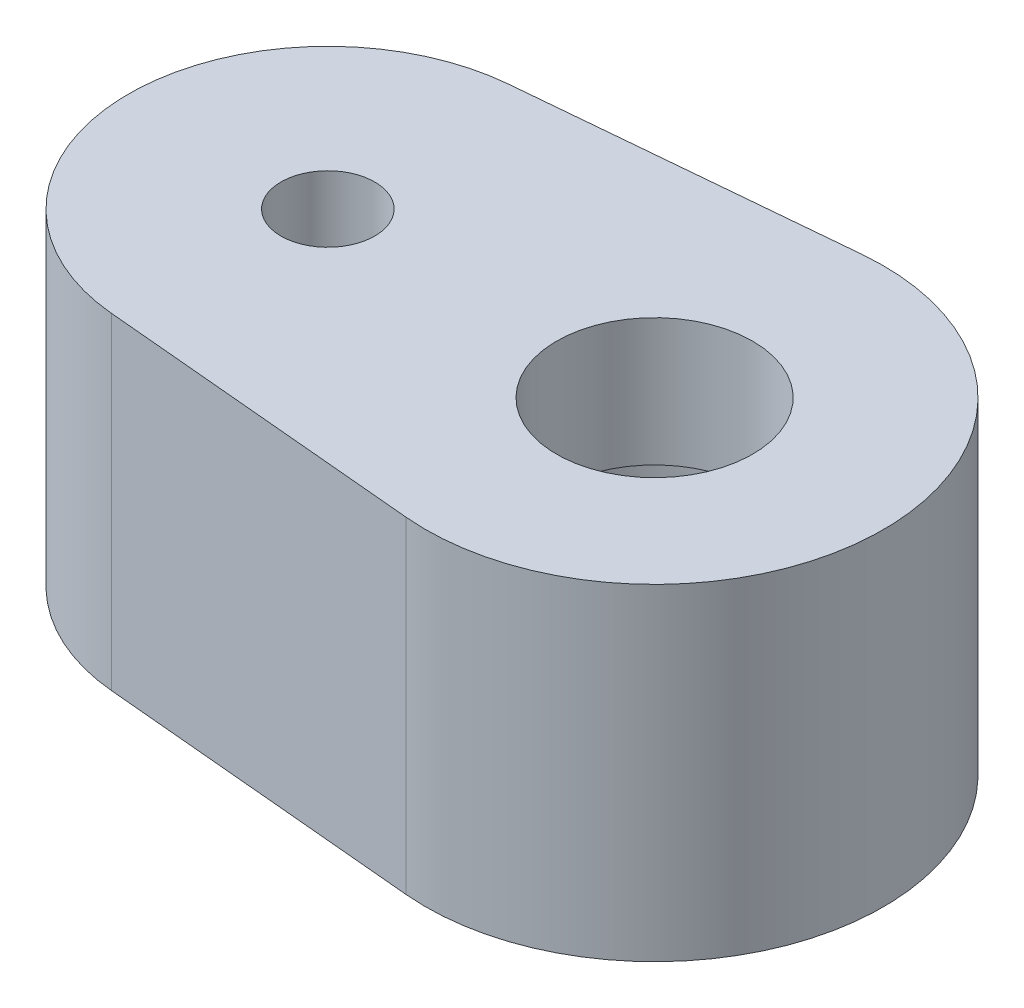
from build123d import *

# Parameters (mm, degrees)
BOSS_EXTRUDE1_DEPTH      = 1
BOSS_EXTRUDE1_DEPTH_BACK = 1
CUT_EXTRUDE1_REACH       = 6.041
SKETCH5_R                = 0.28702


with BuildPart() as part:
    # Sketch1 → Boss-Extrude1 (new, two sides: drawn at the far end of the back side and taken through both)
    with BuildSketch(Plane(origin=(0, 0, 0), x_dir=(1, 0, 0), z_dir=(0, 1, 0)).offset(-BOSS_EXTRUDE1_DEPTH_BACK)):
        with BuildLine():
            Line((-2.1098, 1.215048954), (-0.126, 1.394318472))
            ThreePointArc((-0.126, 1.394318472), (1.4, 0), (-0.126, -1.394318472))
            Line((-0.126, -1.394318472), (-2.1098, -1.215048954))
            ThreePointArc((-2.1098, -1.215048954), (-3.22, 0), (-2.1098, 1.215048954))
        make_face()
    extrude(amount=BOSS_EXTRUDE1_DEPTH + BOSS_EXTRUDE1_DEPTH_BACK)

    # Sketch4 → Cut-Revolve1 (revolve, cut)
    with BuildSketch(Plane.XY, mode=Mode.PRIVATE) as cut_revolve1_sk:
        Polygon((0.85, 0), (0.85, 0.075), (0.6, 0.219337567), (0.6, 1), (0, 1), (0, -1), (0.6, -1), (0.6, -0.219337567), (0.85, -0.075), align=None)
    revolve(cut_revolve1_sk.sketch.rotate(Axis((0, -1, 0), (0, 1, 0)), 90), axis=Axis((0, -1, 0), (0, 1, 0)), mode=Mode.SUBTRACT)

    # Sketch5 → Cut-Extrude1 (cut, up to next)
    with BuildSketch(Plane(origin=(0, 1, 0), x_dir=(1, 0, 0), z_dir=(0, 1, 0)), mode=Mode.PRIVATE) as cut_extrude1_sk1:
        with Locations(Location((-2, 0, 0), (0, 0, 270))):
            Circle(SKETCH5_R)
    cut_extrude1_tool1 = extrude(cut_extrude1_sk1.sketch, amount=-CUT_EXTRUDE1_REACH, mode=Mode.PRIVATE) & part.part
    add(cut_extrude1_tool1.solids().sort_by_distance((-2, 1, 0))[0], mode=Mode.SUBTRACT)


solid = part.part
